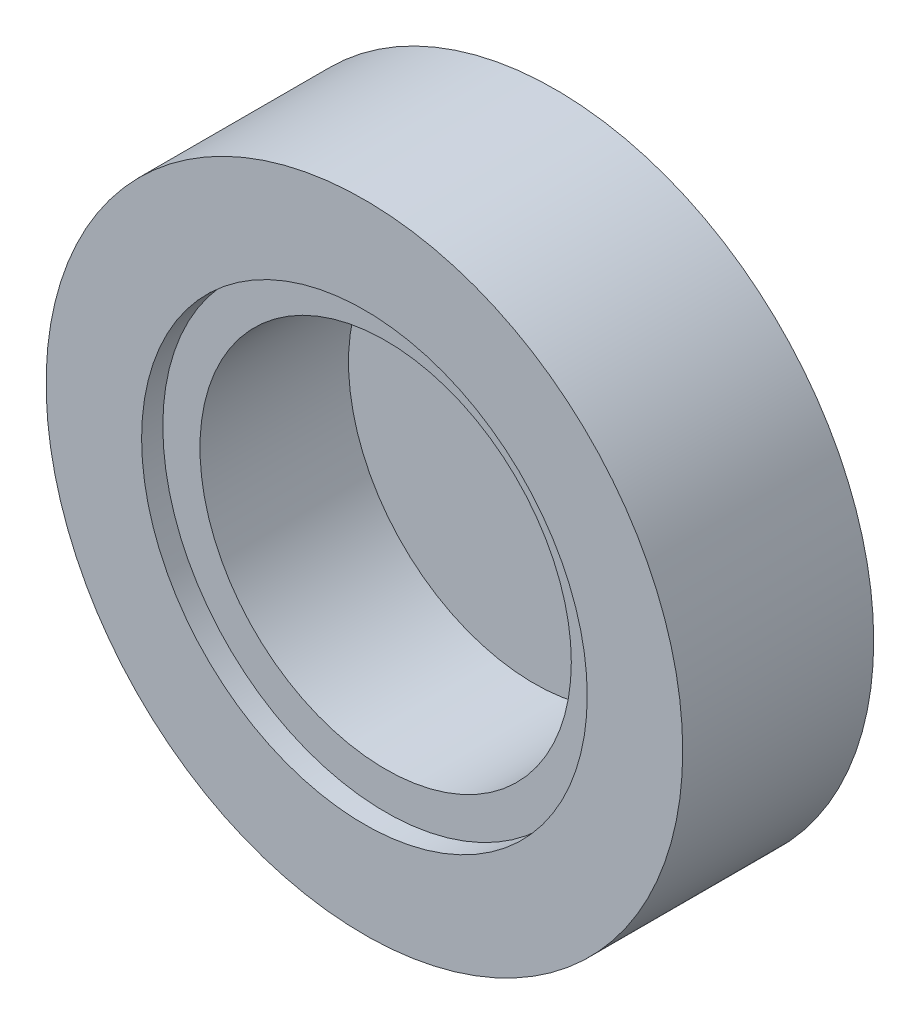
from build123d import *

# Parameters (mm, degrees)
SKETCH1_R           = 30
BOSS_EXTRUDE1_DEPTH = 18
SKETCH2_R           = 17.5
CUT_EXTRUDE1_DEPTH  = 16
SKETCH4_R           = 21
CUT_EXTRUDE2_DEPTH  = 2


with BuildPart() as part:
    # Sketch1 → Boss-Extrude1 (new body)
    with BuildSketch(Plane.XY):
        Circle(SKETCH1_R)
    extrude(amount=BOSS_EXTRUDE1_DEPTH)

    # Sketch2 → Cut-Extrude1 (cut)
    with BuildSketch(Plane.XY.offset(18)):
        Circle(SKETCH2_R)
    extrude(amount=-CUT_EXTRUDE1_DEPTH, mode=Mode.SUBTRACT)

    # Sketch4 → Cut-Extrude2 (cut)
    with BuildSketch(Plane.XY.offset(18)):
        Circle(SKETCH4_R)
    extrude(amount=-CUT_EXTRUDE2_DEPTH, mode=Mode.SUBTRACT)


solid = part.part
